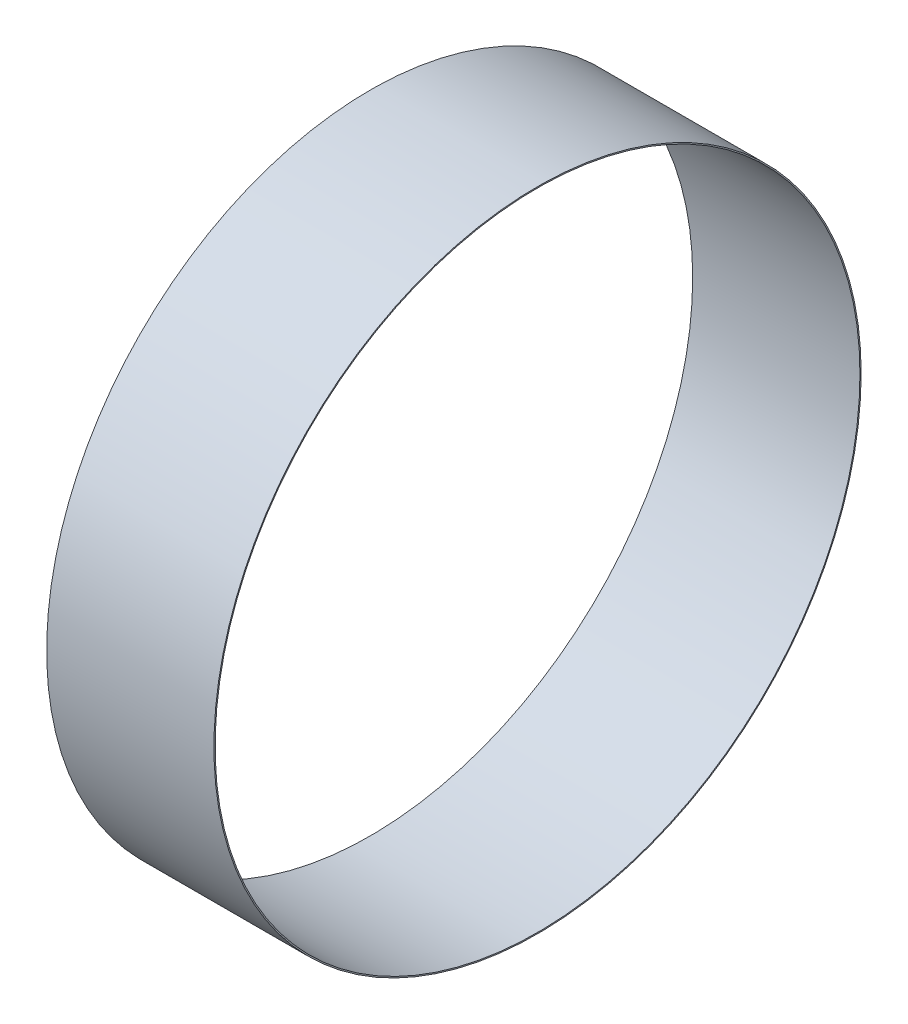
from build123d import *

# Parameters (mm, degrees)
SKETCH1_R           = 803
SKETCH1_R_2         = 800
BOSS_EXTRUDE1_DEPTH = 415


with BuildPart() as part:
    # Sketch1 → Boss-Extrude1 (new body)
    with BuildSketch(Plane(origin=(0, 0, 0), x_dir=(0, 0, -1), z_dir=(1, 0, 0))):
        Circle(SKETCH1_R)
        Circle(SKETCH1_R_2, mode=Mode.SUBTRACT)
    extrude(amount=BOSS_EXTRUDE1_DEPTH)


solid = part.part
